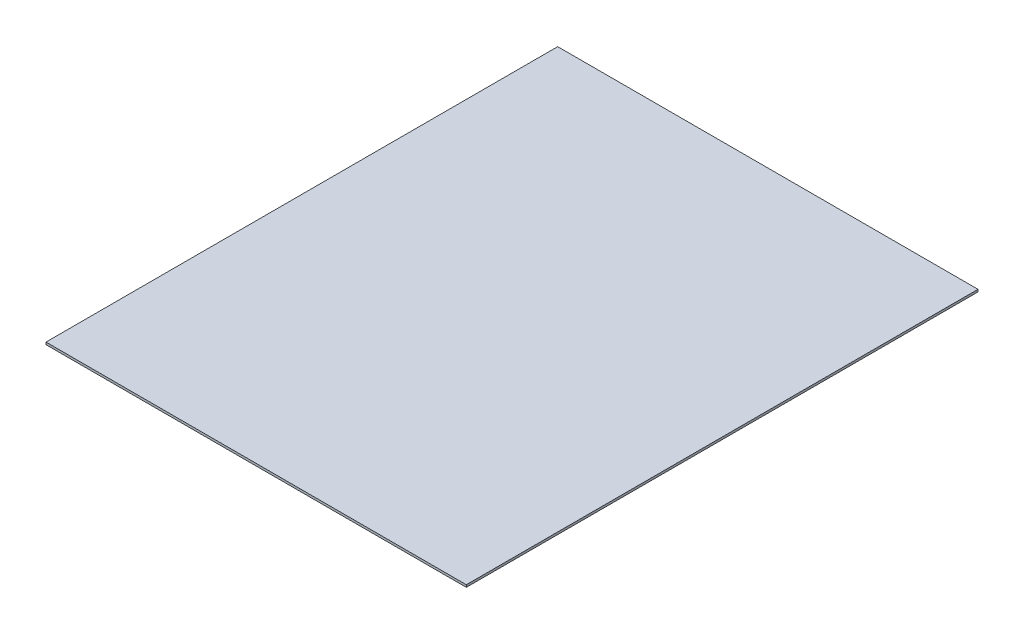
from build123d import *

# Parameters (mm, degrees)
SKETCH1_W           = 584.2
SKETCH1_H           = 711.2
BOSS_EXTRUDE1_DEPTH = 3.175


with BuildPart() as part:
    # Sketch1 → Boss-Extrude1 (new body)
    with BuildSketch(Plane(origin=(0, -25.4, 330.2), x_dir=(1, 0, 0), z_dir=(0, 1, 0))):
        with Locations((0, 330.2)):
            Rectangle(SKETCH1_W, SKETCH1_H)
    extrude(amount=-BOSS_EXTRUDE1_DEPTH)


solid = part.part
